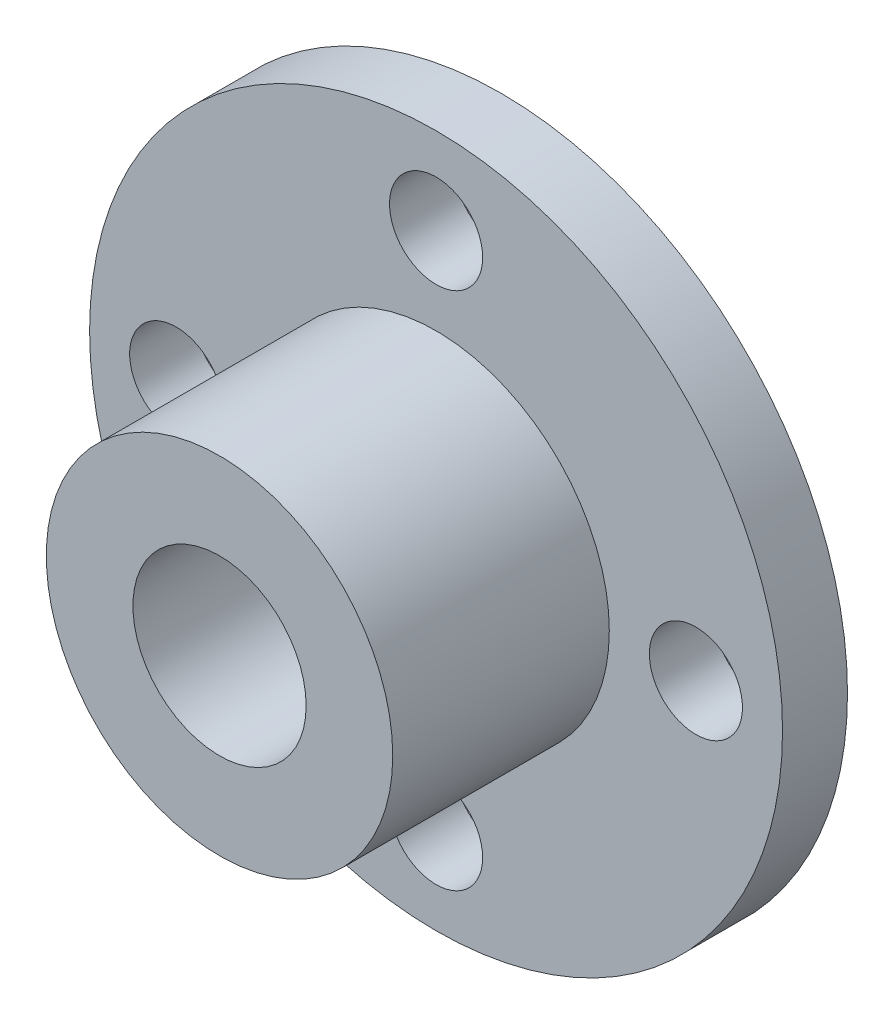
from build123d import *

# Parameters (mm, degrees)
SKETCH_1_R      = 16
SKETCH_1_R_2    = 8
SKETCH_1_R_3    = 2.15
SKETCH_1_R_4    = 4
EXTRUDE_2_DEPTH = 3
SKETCH_2_R      = 8
SKETCH_2_R_2    = 4
EXTRUDE_3_DEPTH = 10


with BuildPart() as part:
    # 草图1 → 凸台-拉伸2 (new body)
    # profile 1 of 3: a face of its own
    with BuildSketch(Plane.XY):
        Circle(SKETCH_1_R)
        Circle(SKETCH_1_R_2, mode=Mode.SUBTRACT)
        with Locations((12, 0)):
            Circle(SKETCH_1_R_3, mode=Mode.SUBTRACT)
        with Locations((-12, 0)):
            Circle(SKETCH_1_R_3, mode=Mode.SUBTRACT)
        with Locations((0, -12)):
            Circle(SKETCH_1_R_3, mode=Mode.SUBTRACT)
        with Locations((0, 12)):
            Circle(SKETCH_1_R_3, mode=Mode.SUBTRACT)
    # profile 2 of 3: a face of its own
    with BuildSketch(Plane.XY):
        Circle(SKETCH_1_R_2)
        Circle(SKETCH_1_R_4, mode=Mode.SUBTRACT)
    # profile 3 of 3: a face of its own
    with BuildSketch(Plane.XY):
        Circle(SKETCH_1_R_4)
    extrude(amount=EXTRUDE_2_DEPTH)

    # 草图2 → 凸台-拉伸3 (add)
    with BuildSketch(Plane.XY.offset(3)):
        Circle(SKETCH_2_R)
        Circle(SKETCH_2_R_2, mode=Mode.SUBTRACT)
    extrude(amount=EXTRUDE_3_DEPTH)


solid = part.part
